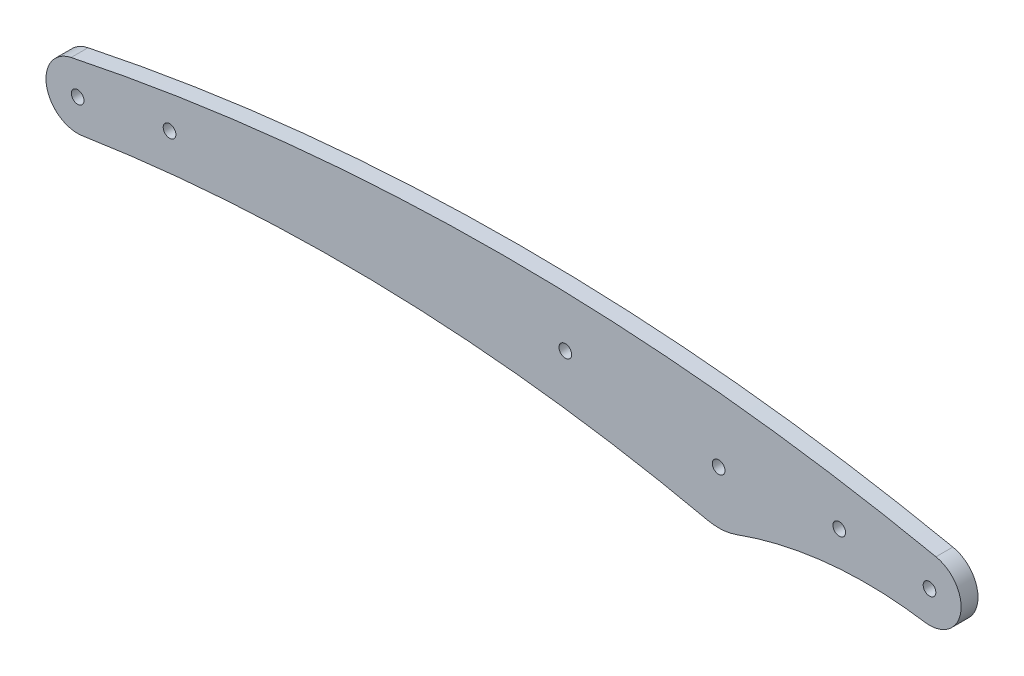
from build123d import *

# Parameters (mm, degrees)
SCHIZZO1_R                   = 1.5
ESTRUSIONE_ESTRUSIONE1_DEPTH = 4
SCHIZZO2_R                   = 1.5
TAGLIO_ESTRUSIONE1_DEPTH     = 10


with BuildPart() as part:
    # Schizzo1 → Estrusione-Estrusione1 (new body)
    with BuildSketch(Plane.XY):
        with BuildLine():
            ThreePointArc((-1.538071066, 7.340595166), (-7.378454008, -1.344773756), (1.150548918, -7.411223731))
            ThreePointArc((1.150548918, -7.411223731), (75.443261143, -2.885528453), (149.288277512, -12.20231786))
            ThreePointArc((149.288277512, -12.20231786), (152.810661847, -12.473685396), (156.268292683, -11.748688334))
            ThreePointArc((156.268292683, -11.748688334), (178.283063002, -6.762377854), (200.846153846, -7.410711103))
            ThreePointArc((200.846153846, -7.410711103), (209.378154672, -1.346415107), (203.538071066, 7.340595166))
            ThreePointArc((203.538071066, 7.340595166), (101, 17.967584078), (-1.538071066, 7.340595166))
        make_face()
        Circle(SCHIZZO1_R, mode=Mode.SUBTRACT)
        with Locations((202, 0)):
            Circle(SCHIZZO1_R, mode=Mode.SUBTRACT)
        with Locations((152, 0)):
            Circle(SCHIZZO1_R, mode=Mode.SUBTRACT)
    extrude(amount=ESTRUSIONE_ESTRUSIONE1_DEPTH)

    # Schizzo2 → Taglio-Estrusione1 (cut)
    with BuildSketch(Plane.XY.offset(4)):
        with Locations((21.792647349, 3.923925867)):
            Circle(SCHIZZO2_R)
        with Locations((115.643522851, 5.673925867)):
            Circle(SCHIZZO2_R)
        with Locations((180.602574062, 1.58663817)):
            Circle(SCHIZZO2_R)
    extrude(amount=-TAGLIO_ESTRUSIONE1_DEPTH, mode=Mode.SUBTRACT)


solid = part.part
